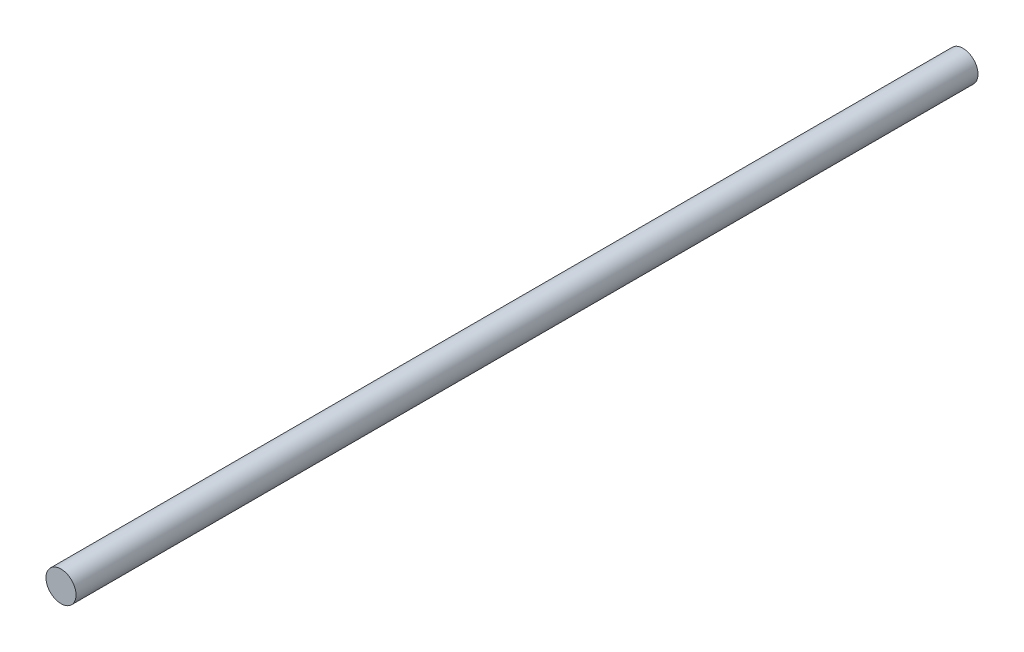
from build123d import *

# Parameters (mm, degrees)
SKETCH_1_R      = 2
EXTRUDE_1_DEPTH = 120


with BuildPart() as part:
    # Эскиз1 → Вытянуть1 (new body)
    with BuildSketch(Plane.XY):
        Circle(SKETCH_1_R)
    extrude(amount=EXTRUDE_1_DEPTH)


solid = part.part
